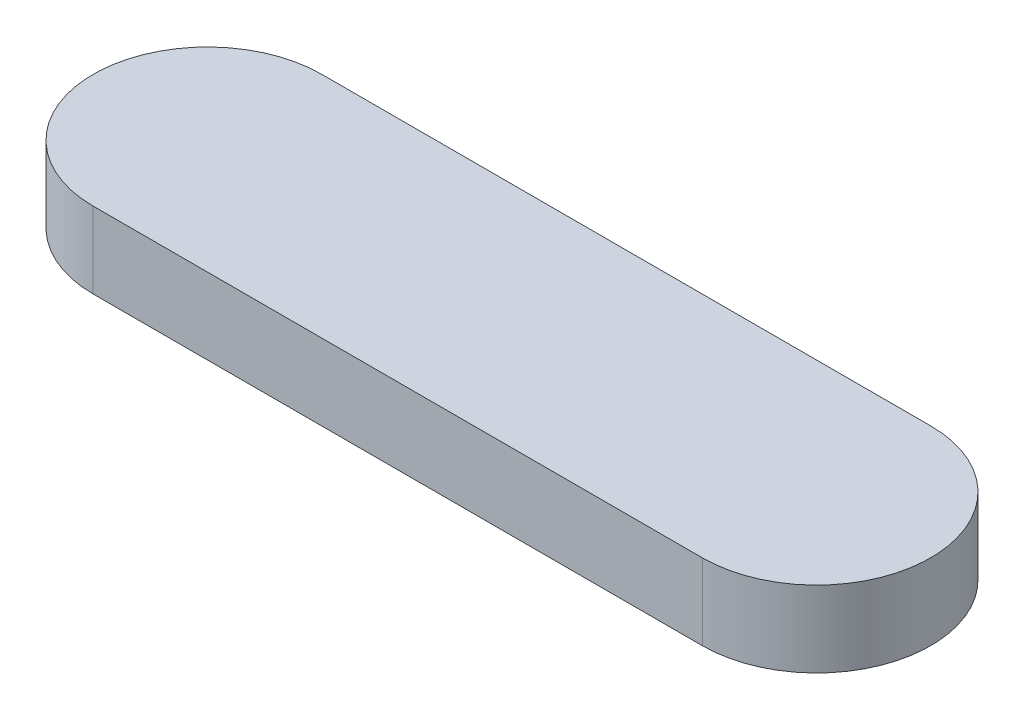
from build123d import *

# Parameters (mm, degrees)
EXTRUDE_1_DEPTH = 50


with BuildPart() as part:
    # 草图1 → 凸台-拉伸1 (new body)
    with BuildSketch(Plane(origin=(0, 0, 0), x_dir=(1, 0, 0), z_dir=(0, 1, 0))):
        with BuildLine():
            Line((0, 75), (400, 75))
            ThreePointArc((400, 75), (475, 0), (400, -75))
            Line((400, -75), (0, -75))
            ThreePointArc((0, -75), (-75, 0), (0, 75))
        make_face()
    extrude(amount=EXTRUDE_1_DEPTH)


solid = part.part
